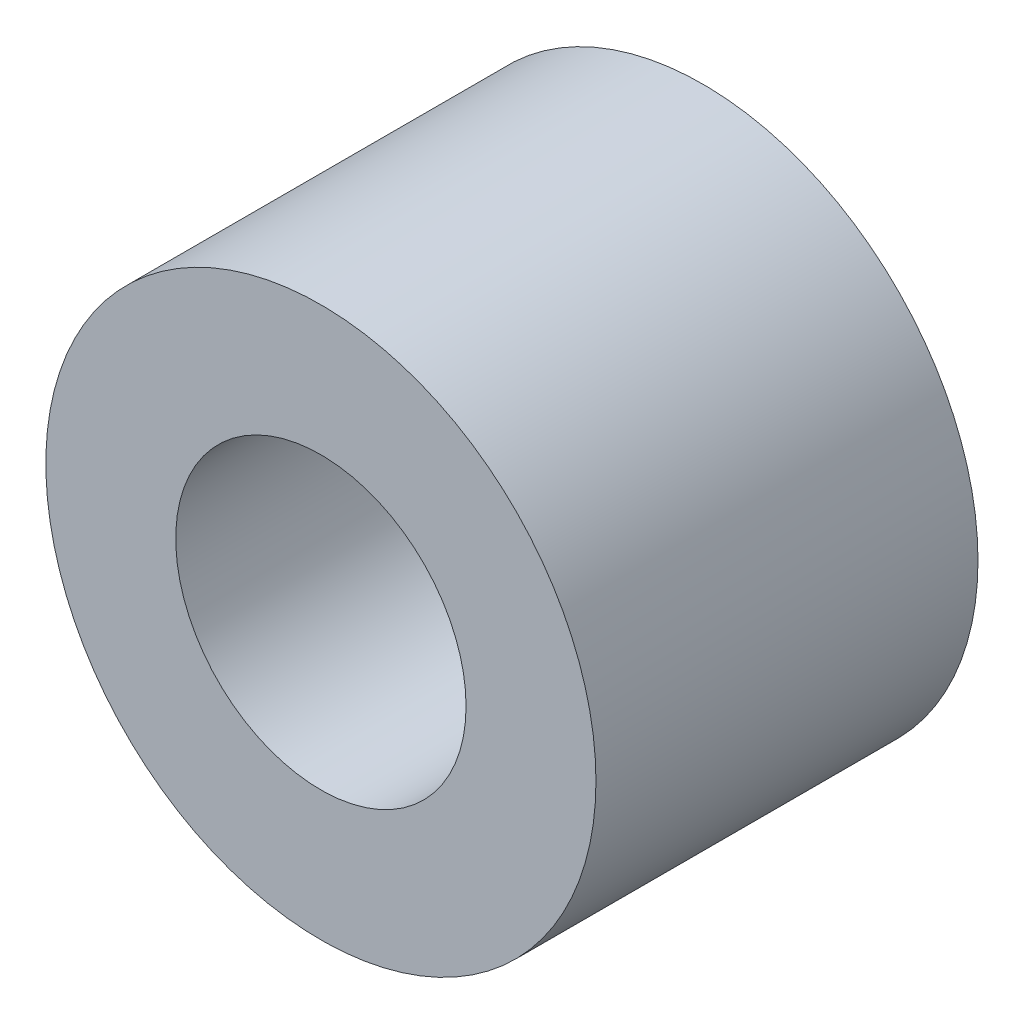
from build123d import *

# Parameters (mm, degrees)
SKETCH1_R           = 4.572
SKETCH1_R_2         = 2.413
BOSS_EXTRUDE1_DEPTH = 6.35


with BuildPart() as part:
    # Sketch1 → Boss-Extrude1 (new body)
    with BuildSketch(Plane.XY):
        with Locations((-4.476297689, 4.732086128)):
            Circle(SKETCH1_R)
        with Locations((-4.476297689, 4.732086128)):
            Circle(SKETCH1_R_2, mode=Mode.SUBTRACT)
    extrude(amount=BOSS_EXTRUDE1_DEPTH)


solid = part.part
